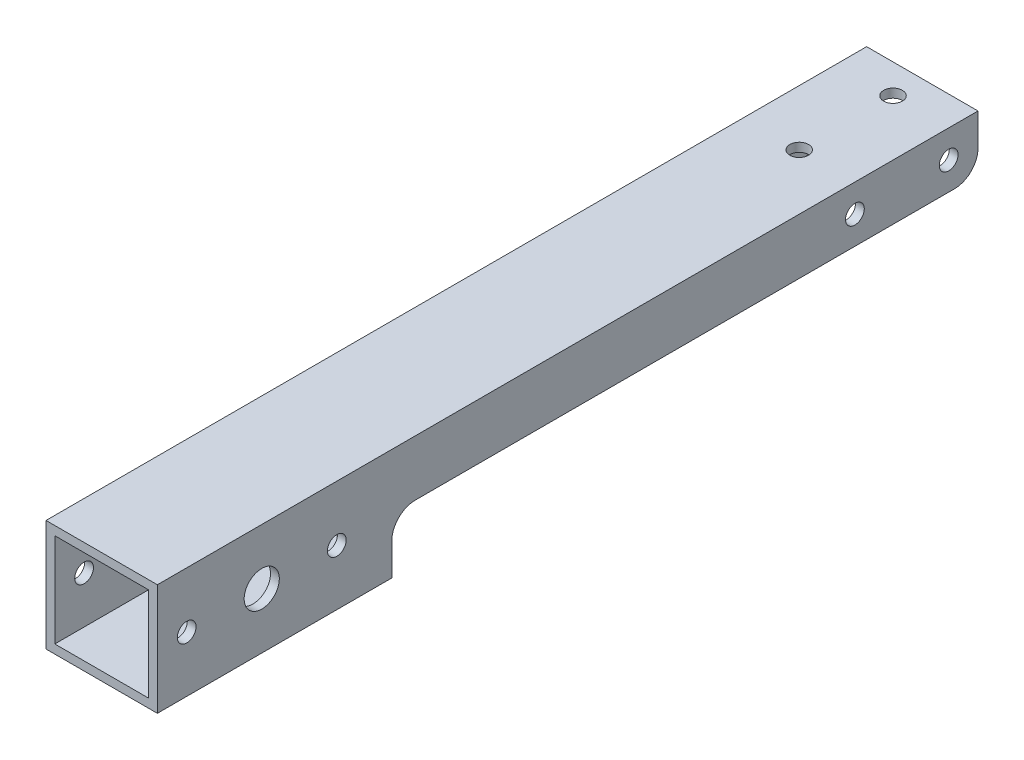
from build123d import *

# Parameters (mm, degrees)
ESBO_O1_W                = 19
ESBO_O1_H                = 19
ESBO_O1_W_2              = 16
ESBO_O1_H_2              = 16
RESSALTO_EXTRUS_O1_DEPTH = 140
ESBO_O2_R                = 1.6
ESBO_O2_R_2              = 3
CORTE_EXTRUS_O1_DEPTH    = 142.60243642
ESBO_O3_R                = 1.6
CORTE_EXTRUS_O2_DEPTH    = 1.5
ESBO_O5_W                = 19
ESBO_O5_H                = 9.5
CORTE_EXTRUS_O4_DEPTH    = 100
FILETE1_R                = 4


with BuildPart() as part:
    # Esboço1 → Ressalto-extrusão1 (new body)
    with BuildSketch(Plane.XY):
        Rectangle(ESBO_O1_W, ESBO_O1_H)
        Rectangle(ESBO_O1_W_2, ESBO_O1_H_2, mode=Mode.SUBTRACT)
    extrude(amount=RESSALTO_EXTRUS_O1_DEPTH)

    # Esboço2 → Corte-extrusão1 (cut, through all)
    with BuildSketch(Plane(origin=(9.5, 0, 0), x_dir=(0, 0, -1), z_dir=(1, 0, 0))):
        with Locations((-109.38750305, 0)):
            Circle(ESBO_O2_R)
        with Locations((-135, 0)):
            Circle(ESBO_O2_R)
        with Locations((-122.193751525, 0)):
            Circle(ESBO_O2_R_2)
        with Locations((-5, 4.75)):
            Circle(ESBO_O2_R)
        with Locations((-21, 4.75)):
            Circle(ESBO_O2_R)
    extrude(amount=-CORTE_EXTRUS_O1_DEPTH, mode=Mode.SUBTRACT)

    # Esboço3 → Corte-extrusão2 (cut)
    with BuildSketch(Plane(origin=(0, 9.5, 0), x_dir=(1, 0, 0), z_dir=(0, 1, 0))):
        with Locations(Location((0, -21, 0), (0, 0, 270))):
            Circle(ESBO_O3_R)
        with Locations(Location((0, -5, 0), (0, 0, 270))):
            Circle(ESBO_O3_R)
    extrude(amount=-CORTE_EXTRUS_O2_DEPTH, mode=Mode.SUBTRACT)

    # Esboço5 → Corte-extrusão4 (cut)
    with BuildSketch(Plane(origin=(0, 0, 0), x_dir=(-1, 0, 0), z_dir=(0, 0, -1))):
        with Locations((0, -4.75)):
            Rectangle(ESBO_O5_W, ESBO_O5_H)
    extrude(amount=-CORTE_EXTRUS_O4_DEPTH, mode=Mode.SUBTRACT)

    # Filete1
    filete1_edges = [part.edges().sort_by_distance(p)[0] for p in [
        (-8.75, 0, 0),
        (8.75, 0, 0),
        (-8.75, 0, 100),
        (8.75, 0, 100),
    ]]
    fillet(filete1_edges, radius=FILETE1_R)


solid = part.part
